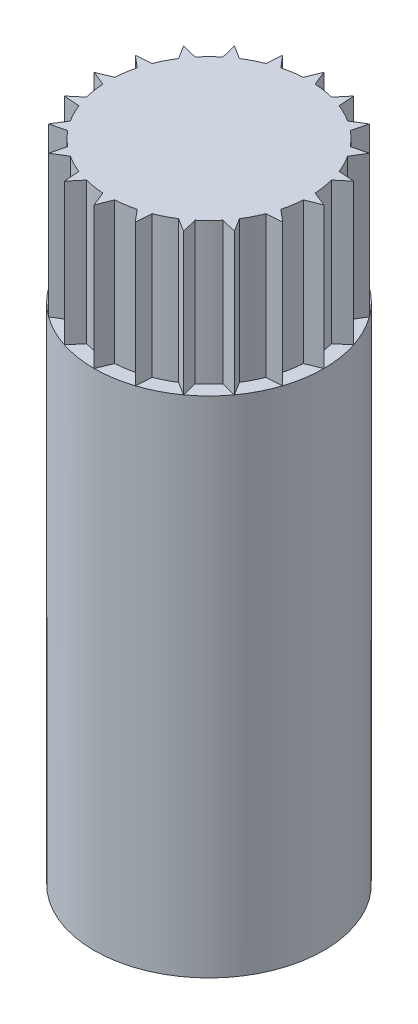
from build123d import *

# Parameters (mm, degrees)
SKETCH1_R           = 4.86
BOSS_EXTRUDE1_DEPTH = 21.336
BOSS_EXTRUDE2_DEPTH = 6


with BuildPart() as part:
    # Sketch1 → Boss-Extrude1 (new body)
    with BuildSketch(Plane(origin=(0, 0, 0), x_dir=(1, 0, 0), z_dir=(0, 1, 0))):
        with Locations(Location((0, 0, 0), (0, 0, 270))):
            Circle(SKETCH1_R)
    extrude(amount=BOSS_EXTRUDE1_DEPTH)

    # Sketch2 → Boss-Extrude2 (add)
    with BuildSketch(Plane(origin=(0, 21.336, 0), x_dir=(1, 0, 0), z_dir=(0, 1, 0))):
        with BuildLine():
            Line((0, 4.86), (0.250754017, 4.242596189))
            ThreePointArc((0.250754017, 4.242596189), (0.664846476, 4.197675448), (1.072553081, 4.112436004))
            Line((1.072553081, 4.112436004), (1.501822593, 4.622134669))
            Line((1.501822593, 4.622134669), (1.549515564, 3.957461499))
            ThreePointArc((1.549515564, 3.957461499), (1.929459624, 3.786777728), (2.29087121, 3.57972193))
            Line((2.29087121, 3.57972193), (2.856636326, 3.931822593))
            Line((2.856636326, 3.931822593), (2.696599732, 3.284942904))
            ThreePointArc((2.696599732, 3.284942904), (3.00520382, 3.00520382), (3.284942904, 2.696599732))
            Line((3.284942904, 2.696599732), (3.931822593, 2.856636326))
            Line((3.931822593, 2.856636326), (3.57972193, 2.29087121))
            ThreePointArc((3.57972193, 2.29087121), (3.786777728, 1.929459624), (3.957461499, 1.549515564))
            Line((3.957461499, 1.549515564), (4.622134669, 1.501822593))
            Line((4.622134669, 1.501822593), (4.112436004, 1.072553081))
            ThreePointArc((4.112436004, 1.072553081), (4.197675448, 0.664846476), (4.242596189, 0.250754017))
            Line((4.242596189, 0.250754017), (4.86, 0))
            Line((4.86, 0), (4.242596189, -0.250754017))
            ThreePointArc((4.242596189, -0.250754017), (4.197675448, -0.664846476), (4.112436004, -1.072553081))
            Line((4.112436004, -1.072553081), (4.622134669, -1.501822593))
            Line((4.622134669, -1.501822593), (3.957461499, -1.549515564))
            ThreePointArc((3.957461499, -1.549515564), (3.786777728, -1.929459624), (3.57972193, -2.29087121))
            Line((3.57972193, -2.29087121), (3.931822593, -2.856636326))
            Line((3.931822593, -2.856636326), (3.284942904, -2.696599732))
            ThreePointArc((3.284942904, -2.696599732), (3.00520382, -3.00520382), (2.696599732, -3.284942904))
            Line((2.696599732, -3.284942904), (2.856636326, -3.931822593))
            Line((2.856636326, -3.931822593), (2.29087121, -3.57972193))
            ThreePointArc((2.29087121, -3.57972193), (1.929459624, -3.786777728), (1.549515564, -3.957461499))
            Line((1.549515564, -3.957461499), (1.501822593, -4.622134669))
            Line((1.501822593, -4.622134669), (1.072553081, -4.112436004))
            ThreePointArc((1.072553081, -4.112436004), (0.664846476, -4.197675448), (0.250754017, -4.242596189))
            Line((0.250754017, -4.242596189), (0, -4.86))
            Line((0, -4.86), (-0.250754017, -4.242596189))
            ThreePointArc((-0.250754017, -4.242596189), (-0.664846476, -4.197675448), (-1.072553081, -4.112436004))
            Line((-1.072553081, -4.112436004), (-1.501822593, -4.622134669))
            Line((-1.501822593, -4.622134669), (-1.549515564, -3.957461499))
            ThreePointArc((-1.549515564, -3.957461499), (-1.929459624, -3.786777728), (-2.29087121, -3.57972193))
            Line((-2.29087121, -3.57972193), (-2.856636326, -3.931822593))
            Line((-2.856636326, -3.931822593), (-2.696599732, -3.284942904))
            ThreePointArc((-2.696599732, -3.284942904), (-3.00520382, -3.00520382), (-3.284942904, -2.696599732))
            Line((-3.284942904, -2.696599732), (-3.931822593, -2.856636326))
            Line((-3.931822593, -2.856636326), (-3.57972193, -2.29087121))
            ThreePointArc((-3.57972193, -2.29087121), (-3.786777728, -1.929459624), (-3.957461499, -1.549515564))
            Line((-3.957461499, -1.549515564), (-4.622134669, -1.501822593))
            Line((-4.622134669, -1.501822593), (-4.112436004, -1.072553081))
            ThreePointArc((-4.112436004, -1.072553081), (-4.197675448, -0.664846476), (-4.242596189, -0.250754017))
            Line((-4.242596189, -0.250754017), (-4.86, 0))
            Line((-4.86, 0), (-4.242596189, 0.250754017))
            ThreePointArc((-4.242596189, 0.250754017), (-4.197675448, 0.664846476), (-4.112436004, 1.072553081))
            Line((-4.112436004, 1.072553081), (-4.622134669, 1.501822593))
            Line((-4.622134669, 1.501822593), (-3.957461499, 1.549515564))
            ThreePointArc((-3.957461499, 1.549515564), (-3.786777728, 1.929459624), (-3.57972193, 2.29087121))
            Line((-3.57972193, 2.29087121), (-3.931822593, 2.856636326))
            Line((-3.931822593, 2.856636326), (-3.284942904, 2.696599732))
            ThreePointArc((-3.284942904, 2.696599732), (-3.00520382, 3.00520382), (-2.696599732, 3.284942904))
            Line((-2.696599732, 3.284942904), (-2.856636326, 3.931822593))
            Line((-2.856636326, 3.931822593), (-2.29087121, 3.57972193))
            ThreePointArc((-2.29087121, 3.57972193), (-1.929459624, 3.786777728), (-1.549515564, 3.957461499))
            Line((-1.549515564, 3.957461499), (-1.501822593, 4.622134669))
            Line((-1.501822593, 4.622134669), (-1.072553081, 4.112436004))
            ThreePointArc((-1.072553081, 4.112436004), (-0.664846476, 4.197675448), (-0.250754017, 4.242596189))
            Line((-0.250754017, 4.242596189), (0, 4.86))
        make_face()
    extrude(amount=BOSS_EXTRUDE2_DEPTH)


solid = part.part
